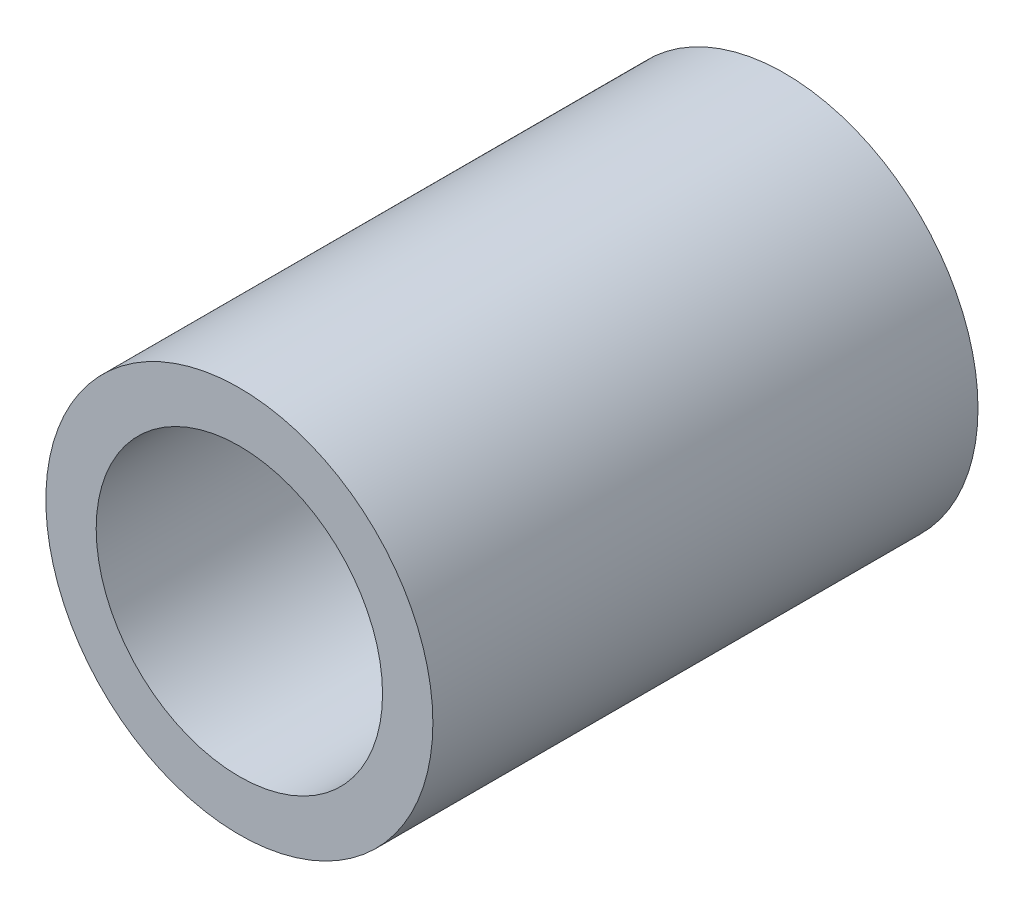
from build123d import *

# Parameters (mm, degrees)
SKETCH1_R           = 10.65
SKETCH1_R_2         = 7.88
EXTRUDE_THIN1_DEPTH = 30


with BuildPart() as part:
    # Sketch1 → Extrude-Thin1 (new body)
    with BuildSketch(Plane.XY):
        Circle(SKETCH1_R)
        Circle(SKETCH1_R_2, mode=Mode.SUBTRACT)
    extrude(amount=EXTRUDE_THIN1_DEPTH)


solid = part.part
